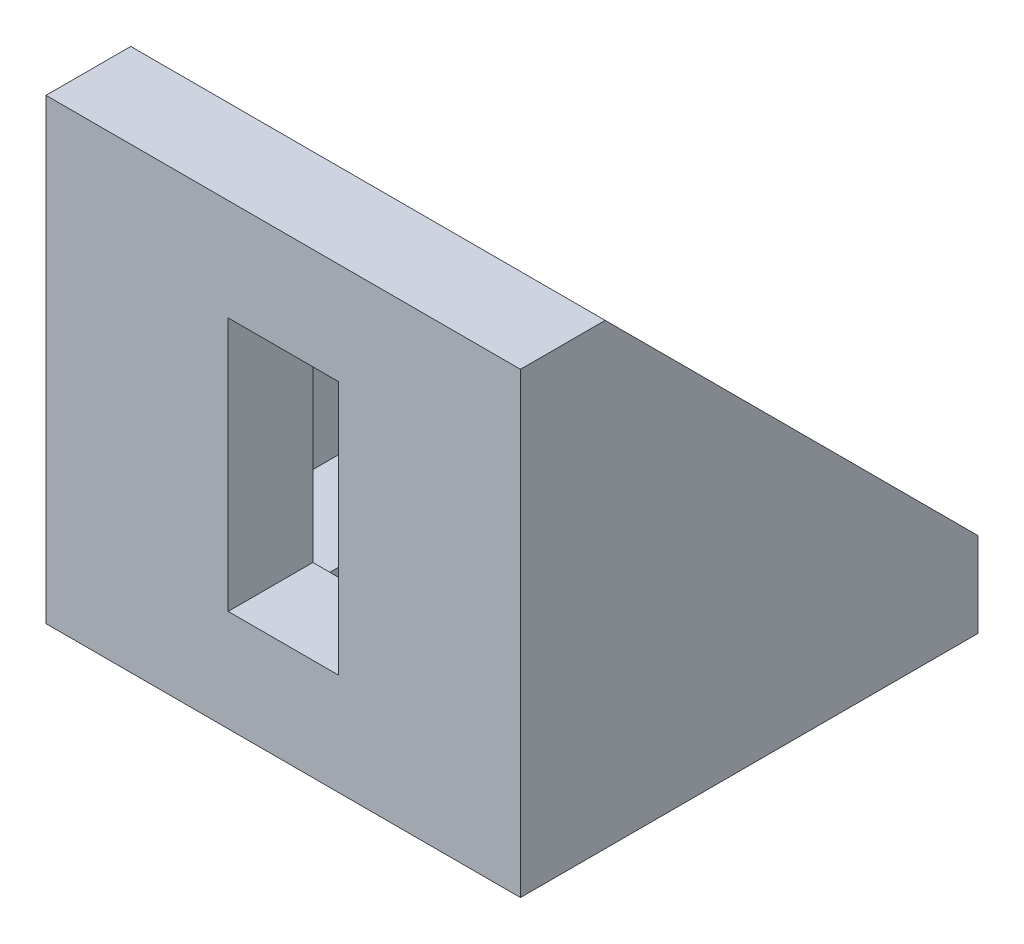
from build123d import *

# Parameters (mm, degrees)
BOSS_EXTRUDE1_DEPTH = 9.333333333
CUT_EXTRUDE1_START  = -3.33333
SKETCH2_W           = 12
SKETCH2_H           = 14.666666667
CUT_EXTRUDE1_DEPTH  = 28
SKETCH3_W           = 4.333333334
SKETCH3_H           = 10
CUT_EXTRUDE2_DEPTH  = 23.910453703


with BuildPart() as part:
    # Sketch1 → Boss-Extrude1 (new, symmetric)
    with BuildSketch(Plane(origin=(0, 0, 0), x_dir=(0, 0, -1), z_dir=(1, 0, 0))):
        Polygon((0, 0), (18, 0), (18, 3.333333333), (10.666666667, 10.666666667), align=None)
    extrude(amount=BOSS_EXTRUDE1_DEPTH, both=True)

    # Sketch2 → Cut-Extrude1 (cut)
    with BuildSketch(Plane.XZ.offset(CUT_EXTRUDE1_START)):
        with Locations((0, -10.666666666)):
            Rectangle(SKETCH2_W, SKETCH2_H)
    extrude(amount=-CUT_EXTRUDE1_DEPTH, mode=Mode.SUBTRACT)

    # Sketch3 → Cut-Extrude2 (cut, through all)
    with BuildSketch(Plane.XZ):
        with Locations((0, -9)):
            Rectangle(SKETCH3_W, SKETCH3_H)
    extrude(amount=-CUT_EXTRUDE2_DEPTH, mode=Mode.SUBTRACT)

    # Mirror1: part across plane


with BuildPart() as part_1:
    add(part.part)
    add(part.part.mirror(Plane(origin=(9.333333333, 10.666666667, -10.666666667), x_dir=(0, -0.707106781186544, 0.7071067811865509), z_dir=(0, -0.707106781186551, -0.707106781186544))))


solid = part_1.part
